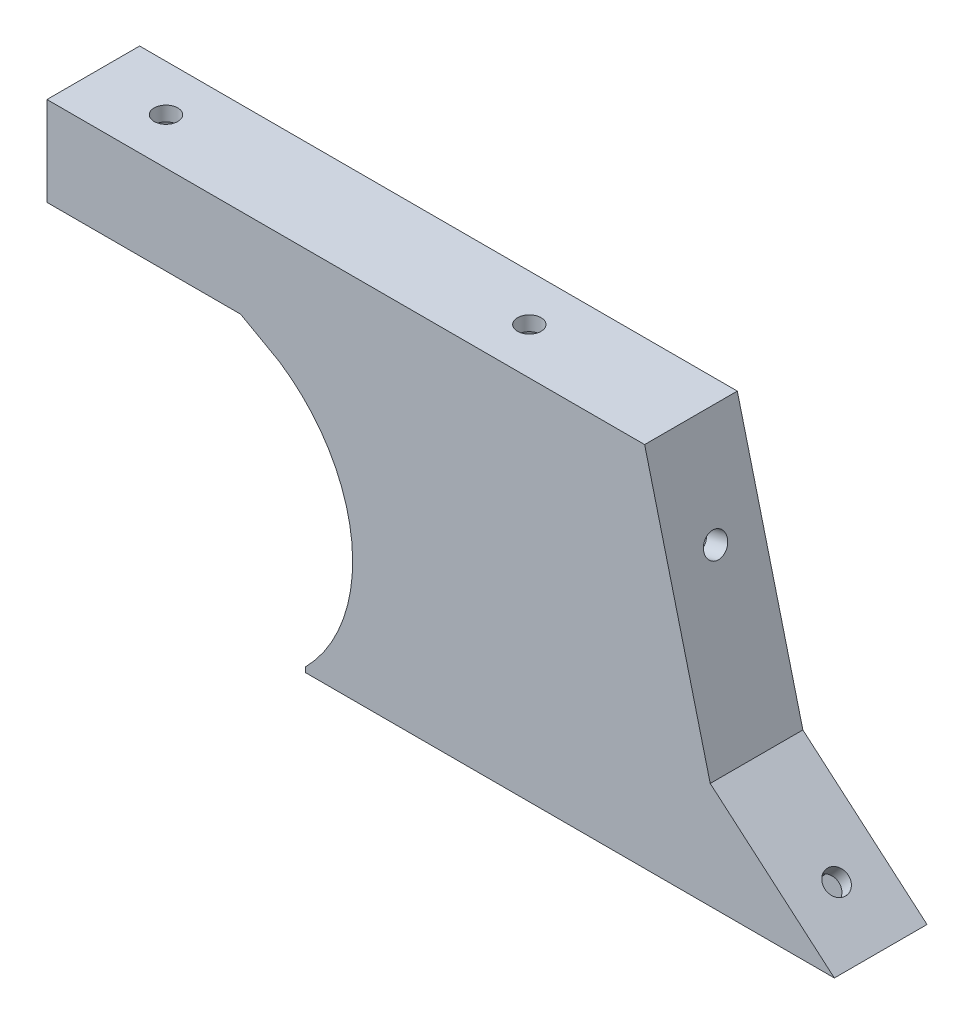
from build123d import *

# Parameters (mm, degrees)
SALIENTE_EXTRUIR1_DEPTH = 3
SALIENTE_EXTRUIR2_DEPTH = 9.75
CROQUIS6_R              = 1.625
CORTAR_EXTRUIR1_DEPTH   = 5
CORTAR_EXTRUIR2_DEPTH   = 2
CORTAR_EXTRUIR4_DEPTH   = 10
CROQUIS10_R             = 1.625
SALIENTE_EXTRUIR3_DEPTH = 2
CROQUIS12_R             = 1.625
CORTAR_EXTRUIR5_DEPTH   = 5
CORTAR_EXTRUIR6_DEPTH   = 2
CROQUIS14_R             = 1.625
CORTAR_EXTRUIR7_DEPTH   = 4
CORTAR_EXTRUIR8_DEPTH   = 2
CROQUIS17_R             = 1.625
CORTAR_EXTRUIR9_DEPTH   = 4
CORTAR_EXTRUIR10_DEPTH  = 2


with BuildPart() as part:
    # Croquis1 → Saliente-Extruir1 (new body)
    with BuildSketch(Plane.XY):
        with BuildLine():
            Line((0, 0.68070798), (0, 0))
            Line((0, 0), (72.78319995, 0))
            Line((72.78319995, 0), (55.699999998, 14.642073221))
            Line((55.699999998, 14.642073221), (46.67593732, 50.511923567))
            Line((46.67593732, 50.511923567), (-35.562657036, 50.511923567))
            Line((-35.562657036, 50.511923567), (-35.562657036, 38.25))
            Line((-35.562657036, 38.25), (-8.913300435, 38.25))
            Line((-8.913300435, 38.25), (-3.562657036, 35.25))
            ThreePointArc((-3.562657036, 35.25), (6.381456753, 18.806597842), (0, 0.68070798))
        make_face()
    extrude(amount=-SALIENTE_EXTRUIR1_DEPTH)

    # Croquis5 → Saliente-Extruir2 (add)
    with BuildSketch(Plane(origin=(0, 0, -3), x_dir=(-1, 0, 0), z_dir=(0, 0, -1))):
        with BuildLine():
            Line((-51.238983488, 11.880365447), (-59.266443595, 5))
            Line((-59.266443595, 5), (-3.339079606, 5))
            ThreePointArc((-3.339079606, 5), (-1.801031086, 2.738703104), (0, 0.68070798))
            Line((0, 0.68070798), (0, 0))
            Line((0, 0), (-72.78319995, 0))
            Line((-72.78319995, 0), (-55.699999998, 14.642073221))
            Line((-55.699999998, 14.642073221), (-46.67593732, 50.511923567))
            Line((-46.67593732, 50.511923567), (35.562657036, 50.511923567))
            Line((35.562657036, 50.511923567), (35.562657036, 38.25))
            Line((35.562657036, 38.25), (31.562657036, 38.25))
            Line((31.562657036, 38.25), (31.562657036, 46.511923567))
            Line((31.562657036, 46.511923567), (-42.526447804, 46.511923567))
            Line((-42.526447804, 46.511923567), (-51.238983488, 11.880365447))
        make_face()
    extrude(amount=SALIENTE_EXTRUIR2_DEPTH)

    # Croquis6 → Cortar-Extruir1 (cut)
    with BuildSketch(Plane.XZ):
        with Locations((6.999999998, -7)):
            Circle(CROQUIS6_R)
        with Locations((52.78319995, -7)):
            Circle(CROQUIS6_R)
    extrude(amount=-CORTAR_EXTRUIR1_DEPTH, mode=Mode.SUBTRACT)

    # Croquis8 → Cortar-Extruir2 (cut)
    with BuildSketch(Plane(origin=(0, 5, 0), x_dir=(1, 0, 0), z_dir=(0, 1, 0))):
        Polygon((3.819999998, 7), (5.409999998, 4.246039216), (8.589999998, 4.246039216), (10.179999998, 7), (8.589999998, 9.753960784), (5.409999998, 9.753960784), align=None)
        Polygon((49.60319995, 7), (51.19319995, 4.246039216), (54.37319995, 4.246039216), (55.96319995, 7), (54.37319995, 9.753960784), (51.19319995, 9.753960784), align=None)
    extrude(amount=-CORTAR_EXTRUIR2_DEPTH, mode=Mode.SUBTRACT)

    # Croquis9 → Cortar-Extruir4 (cut)
    with BuildSketch(Plane(origin=(30.824200619, 35.963211942, 0), x_dir=(0.7592713073348778, -0.6507742172658547, 0), z_dir=(0.6507742172658547, 0.7592713073348778, 0))):
        Polygon((50.442195378, 6.375), (48.852195378, 9.128960784), (45.672195378, 9.128960784), (44.082195378, 6.375), (45.672195378, 3.621039216), (48.852195378, 3.621039216), align=None)
    extrude(amount=-CORTAR_EXTRUIR4_DEPTH, mode=Mode.SUBTRACT)

    # Croquis10 → Saliente-Extruir3 (add)
    with BuildSketch(Plane(origin=(30.824200619, 35.963211942, 0), x_dir=(0.7592713073348778, -0.6507742172658547, 0), z_dir=(0.6507742172658547, 0.7592713073348778, 0))):
        Polygon((50.442195378, 6.375), (48.852195378, 9.128960784), (45.672195378, 9.128960784), (44.082195378, 6.375), (45.672195378, 3.621039216), (48.852195378, 3.621039216), align=None)
        with Locations(Location((47.262195378, 6.375, 0), (0, 0, 180))):
            Circle(CROQUIS10_R, mode=Mode.SUBTRACT)
    extrude(amount=-SALIENTE_EXTRUIR3_DEPTH)

    # Croquis12 → Cortar-Extruir5 (cut)
    with BuildSketch(Plane(origin=(55.848866467, 14.050342186, 0), x_dir=(0, 0, -1), z_dir=(0.9697813730803216, 0.243975589816781, 0))):
        with Locations(Location((6.375, 23.727396855, 0), (0, 0, 90))):
            Circle(CROQUIS12_R)
    extrude(amount=-CORTAR_EXTRUIR5_DEPTH, mode=Mode.SUBTRACT)

    # Croquis13 → Cortar-Extruir6 (cut)
    with BuildSketch(Plane(origin=(50.999959602, 12.830464236, 0), x_dir=(0, 0, 1), z_dir=(-0.9697813730803215, -0.2439755898167812, 0))):
        Polygon((-6.375, 20.547396855), (-3.621039216, 22.137396855), (-3.621039216, 25.317396855), (-6.375, 26.907396855), (-9.128960784, 25.317396855), (-9.128960784, 22.137396855), align=None)
    extrude(amount=-CORTAR_EXTRUIR6_DEPTH, mode=Mode.SUBTRACT)

    # Croquis14 → Cortar-Extruir7 (cut)
    with BuildSketch(Plane(origin=(0, 50.511923567, 0), x_dir=(1, 0, 0), z_dir=(0, 1, 0))):
        with Locations(Location((-25.562657036, 6.375, 0), (0, 0, 180))):
            Circle(CROQUIS14_R)
        with Locations(Location((24.437342964, 6.375, 0), (0, 0, 180))):
            Circle(CROQUIS14_R)
    extrude(amount=-CORTAR_EXTRUIR7_DEPTH, mode=Mode.SUBTRACT)

    # Croquis15 → Cortar-Extruir8 (cut)
    with BuildSketch(Plane.XZ.offset(-46.511923567)):
        Polygon((-22.382657036, -6.375), (-23.972657036, -3.621039216), (-27.152657036, -3.621039216), (-28.742657036, -6.375), (-27.152657036, -9.128960784), (-23.972657036, -9.128960784), align=None)
        Polygon((21.257342964, -6.375), (22.847342964, -9.128960784), (26.027342964, -9.128960784), (27.617342964, -6.375), (26.027342964, -3.621039216), (22.847342964, -3.621039216), align=None)
    extrude(amount=-CORTAR_EXTRUIR8_DEPTH, mode=Mode.SUBTRACT)

    # Croquis17 → Cortar-Extruir9 (cut)
    with BuildSketch(Plane.ZY.offset(35.562657036)):
        with Locations((-7.982505966, 42.38)):
            Circle(CROQUIS17_R)
    extrude(amount=-CORTAR_EXTRUIR9_DEPTH, mode=Mode.SUBTRACT)

    # Croquis18 → Cortar-Extruir10 (cut)
    with BuildSketch(Plane(origin=(-31.562657036, 0, 0), x_dir=(0, 0, -1), z_dir=(1, 0, 0))):
        Polygon((7.982505966, 39.2), (10.73646675, 40.79), (10.73646675, 43.97), (7.982505966, 45.56), (5.228545182, 43.97), (5.228545182, 40.79), align=None)
    extrude(amount=-CORTAR_EXTRUIR10_DEPTH, mode=Mode.SUBTRACT)


solid = part.part
